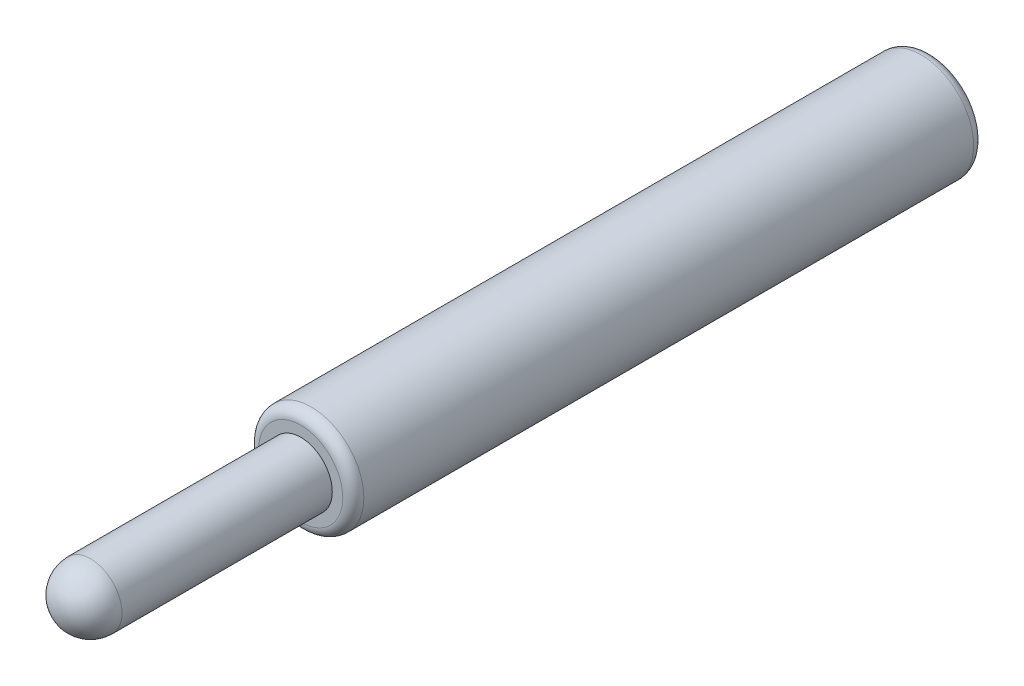
from build123d import *

# Parameters (mm, degrees)
SKETCH_1_R      = 5
EXTRUDE_1_DEPTH = 60
SKETCH_2_R      = 3
EXTRUDE_2_DEPTH = 20
FILLET_1_R      = 1


with BuildPart() as part:
    # 草图1 → 凸台-拉伸1 (new body)
    with BuildSketch(Plane.XY):
        Circle(SKETCH_1_R)
    extrude(amount=-EXTRUDE_1_DEPTH)

    # 草图2 → 凸台-拉伸2 (add)
    with BuildSketch(Plane.XY):
        Circle(SKETCH_2_R)
    extrude(amount=EXTRUDE_2_DEPTH)

    # 圆角1
    fillet_1_edges = [part.edges().sort_by_distance(p)[0] for p in [
        (-5, 0, 0),
        (-5, 0, -60),
    ]]
    fillet(fillet_1_edges, radius=FILLET_1_R)

    # 草图3 → 旋转1 (revolve)
    with BuildSketch(Plane(origin=(0, 0, 0), x_dir=(0, 0, -1), z_dir=(1, 0, 0))):
        with BuildLine():
            Line((-20, 0), (-20, 3))
            ThreePointArc((-20, 3), (-22.121320344, 2.121320344), (-23, 0))
            Line((-23, 0), (-20, 0))
        make_face()
    revolve(axis=Axis((0, 0, 23), (0, 0, -1)))


solid = part.part
